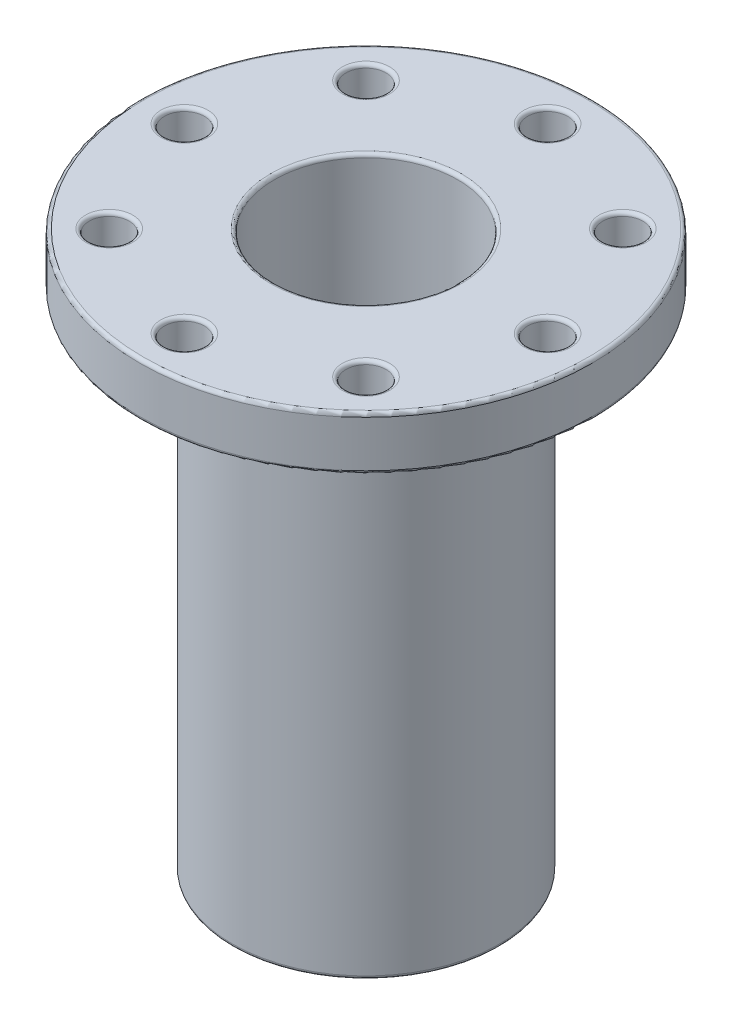
from build123d import *

# Parameters (mm, degrees)
SKETCH1_R           = 25.4
SKETCH1_R_2         = 2.25
BOSS_EXTRUDE1_DEPTH = 6
SKETCH2_R           = 15
BOSS_EXTRUDE2_DEPTH = 62.5
SKETCH3_R           = 10.3125
CUT_EXTRUDE1_DEPTH  = 38.1
SKETCH4_R           = 7.07
CUT_EXTRUDE2_DEPTH  = 73.087238815
FILLET1_R           = 0.4


with BuildPart() as part:
    # Sketch1 → Boss-Extrude1 (new body)
    with BuildSketch(Plane(origin=(0, 0, 0), x_dir=(1, 0, 0), z_dir=(0, 1, 0))):
        with Locations(Location((0, 0, 0), (0, 0, 270))):
            Circle(SKETCH1_R)
        with Locations(Location((0, 20.4, 0), (0, 0, 270))):
            Circle(SKETCH1_R_2, mode=Mode.SUBTRACT)
        with Locations(Location((14.424978336, 14.424978336, 0), (0, 0, 270))):
            Circle(SKETCH1_R_2, mode=Mode.SUBTRACT)
        with Locations(Location((20.4, 0, 0), (0, 0, 270))):
            Circle(SKETCH1_R_2, mode=Mode.SUBTRACT)
        with Locations(Location((14.424978336, -14.424978336, 0), (0, 0, 270))):
            Circle(SKETCH1_R_2, mode=Mode.SUBTRACT)
        with Locations(Location((0, -20.4, 0), (0, 0, 270))):
            Circle(SKETCH1_R_2, mode=Mode.SUBTRACT)
        with Locations(Location((-14.424978336, -14.424978336, 0), (0, 0, 270))):
            Circle(SKETCH1_R_2, mode=Mode.SUBTRACT)
        with Locations(Location((-20.4, 0, 0), (0, 0, 270))):
            Circle(SKETCH1_R_2, mode=Mode.SUBTRACT)
        with Locations(Location((-14.424978336, 14.424978336, 0), (0, 0, 270))):
            Circle(SKETCH1_R_2, mode=Mode.SUBTRACT)
    extrude(amount=BOSS_EXTRUDE1_DEPTH)

    # Sketch2 → Boss-Extrude2 (add)
    with BuildSketch(Plane(origin=(0, 6, 0), x_dir=(1, 0, 0), z_dir=(0, 1, 0))):
        with Locations(Location((0, 0, 0), (0, 0, 270))):
            Circle(SKETCH2_R)
    extrude(amount=-BOSS_EXTRUDE2_DEPTH)

    # Sketch3 → Cut-Extrude1 (cut)
    with BuildSketch(Plane(origin=(0, 6, 0), x_dir=(1, 0, 0), z_dir=(0, 1, 0))):
        with Locations(Location((0, 0, 0), (0, 0, 270))):
            Circle(SKETCH3_R)
    extrude(amount=-CUT_EXTRUDE1_DEPTH, mode=Mode.SUBTRACT)

    # Sketch4 → Cut-Extrude2 (cut, through all)
    with BuildSketch(Plane.XZ.offset(56.5)):
        with Locations(Location((0, 0, 0), (0, 0, 270))):
            Circle(SKETCH4_R)
    extrude(amount=-CUT_EXTRUDE2_DEPTH, mode=Mode.SUBTRACT)

    # Fillet1
    fillet1_edges = [part.edges().sort_by_distance(p)[0] for p in [
        (20.4, 0, -2.25),
        (20.4, 6, -2.25),
        (14.424978336, 0, 12.174978336),
        (14.424978336, 6, 12.174978336),
        (0, 0, -25.4),
        (0, 0, 18.15),
        (0, 6, 18.15),
        (-14.424978336, 0, 12.174978336),
        (-14.424978336, 6, 12.174978336),
        (-20.4, 0, -2.25),
        (-20.4, 6, -2.25),
        (-14.424978336, 0, -16.674978336),
        (-14.424978336, 6, -16.674978336),
        (0, -56.5, -15),
        (0, 0, -15),
        (0, 6, -25.4),
        (0, -32.1, -10.3125),
        (0, 6, -10.3125),
        (0, 0, -22.65),
        (0, -32.1, 7.07),
        (0, -56.5, 7.07),
        (0, 6, -22.65),
        (14.424978336, 0, -16.674978336),
        (14.424978336, 6, -16.674978336),
    ]]
    fillet(fillet1_edges, radius=FILLET1_R)


solid = part.part
